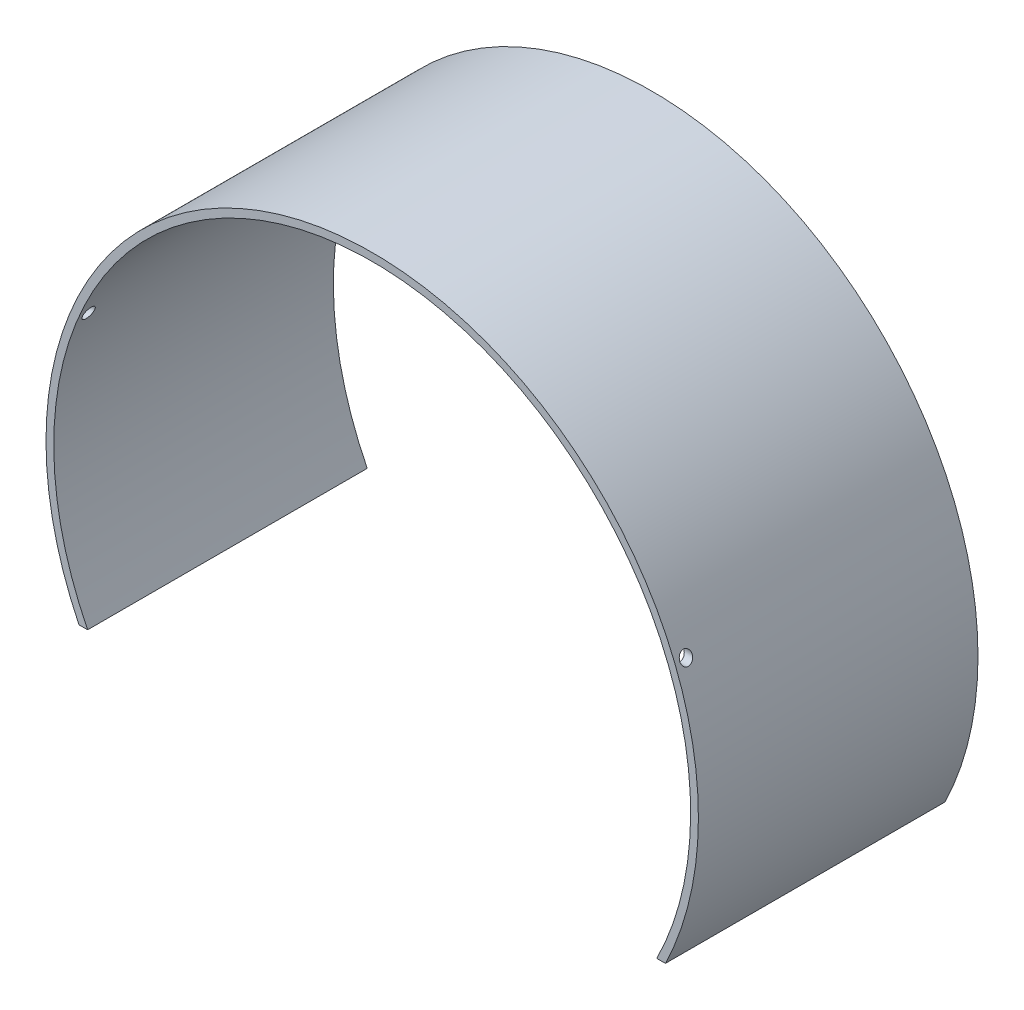
from build123d import *
from build123d.topology import SkipClean

# Parameters (mm, degrees)
SKETCH_1_R          = 210
SKETCH_1_R_2        = 203
EXTRUDE_2_DEPTH     = 174
EXTRUDE_START       = -174
EXTRUDE_4_DEPTH     = 174
CUT_EXTRUDE_1_DEPTH = 654
EXTRUDE_5_DEPTH     = 174
EXTRUDE_6_DEPTH     = 174
EXTRUDE_7_DEPTH     = 174
EXTRUDE_8_DEPTH     = 174
CUT_EXTRUDE_START   = -654
CUT_EXTRUDE_2_DEPTH = 654
SKETCH_10_W         = 20.487801248
SKETCH_10_H         = 174
CUT_EXTRUDE_3_DEPTH = 327
SKETCH_11_W         = 235.63772895
SKETCH_11_H         = 249.192111589
CUT_EXTRUDE_4_DEPTH = 238
EXTRUDE_10_DEPTH    = 180
SKETCH_17_W         = 286.098661696
SKETCH_17_H         = 191.878669743
CUT_EXTRUDE_5_DEPTH = 322
EXTRUDE_11_DEPTH    = 180
SKETCH_20_R         = 4
CUT_EXTRUDE_7_DEPTH = 555.5


with BuildPart() as part:
    # 草图1 → 凸台-拉伸2 (new body)
    with BuildSketch(Plane.XY):
        Circle(SKETCH_1_R)
        Circle(SKETCH_1_R_2, mode=Mode.SUBTRACT)
    extrude(amount=EXTRUDE_2_DEPTH)

    # 草图2 → 凸台-拉伸4 (add)
    with BuildSketch(Plane.XY.offset(174).offset(EXTRUDE_START)):
        with BuildLine():
            Line((-170.735431044, -102), (-173.735431044, -102))
            Line((-173.735431044, -102), (-175.513532242, -102))
            ThreePointArc((-175.513532242, -102), (-174.63092392, -103.50381834), (-173.735431044, -105))
            Line((-173.735431044, -105), (-170.735431044, -105))
            Line((-170.735431044, -105), (-170.735431044, -102))
        make_face()
        with BuildLine():
            ThreePointArc((173.735431044, -105), (174.63092392, -103.50381834), (175.513532242, -102))
            Line((175.513532242, -102), (173.735431044, -102))
            Line((173.735431044, -102), (170.735431044, -102))
            Line((170.735431044, -102), (170.735431044, -105))
            Line((170.735431044, -105), (173.735431044, -105))
        make_face()
    extrude(amount=EXTRUDE_4_DEPTH)

    # 草图3 → 切除-拉伸1 (cut)
    with BuildSketch(Plane.XY.offset(174)):
        Polygon((-170.735431044, -102), (238.333646515, -102), (254.334169784, 272.292523591), (-334.569415043, 221.85110305), (-306.830562533, -102), align=None)
    extrude(amount=-CUT_EXTRUDE_1_DEPTH, mode=Mode.SUBTRACT)

    # 草图5 → 凸台-拉伸5 (add)
    with BuildSketch(Plane.XY.offset(174).offset(EXTRUDE_START)):
        with BuildLine():
            Line((-120, -209.75), (-10.243900624, -209.75))
            ThreePointArc((-10.243900624, -209.75), (-67.755470707, -198.769203322), (-120, -172.336879396))
            Line((-120, -172.336879396), (-120, -209.75))
        make_face()
        with BuildLine():
            ThreePointArc((120, -172.336879396), (67.755470707, -198.769203322), (10.243900624, -209.75))
            Line((10.243900624, -209.75), (120, -209.75))
            Line((120, -209.75), (120, -172.336879396))
        make_face()
    extrude(amount=EXTRUDE_5_DEPTH)

    # 草图6 → 凸台-拉伸6 (add)
    with BuildSketch(Plane.XY.offset(174).offset(EXTRUDE_START)):
        with BuildLine():
            Line((-175.513532242, -102), (-166.195667814, -102))
            ThreePointArc((-166.195667814, -102), (0, -195), (166.195667814, -102))
            Line((166.195667814, -102), (175.513532242, -102))
            ThreePointArc((175.513532242, -102), (0, -203), (-175.513532242, -102))
        make_face()
    extrude(amount=EXTRUDE_6_DEPTH)

    # 草图7 → 凸台-拉伸7 (add)
    with BuildSketch(Plane.XY.offset(174).offset(EXTRUDE_START)):
        with BuildLine():
            Line((-166.933126535, -92), (-166.933126535, -95))
            Line((-166.933126535, -95), (-170.293863659, -95))
            ThreePointArc((-170.293863659, -95), (0, -195), (170.293863659, -95))
            Line((170.293863659, -95), (166.933126535, -95))
            Line((166.933126535, -95), (166.933126535, -92))
            Line((166.933126535, -92), (171.933126535, -92))
            Line((171.933126535, -92), (188.496850106, -92))
            ThreePointArc((188.496850106, -92), (0, -209.75), (-188.496850106, -92))
            Line((-188.496850106, -92), (-171.933126535, -92))
            Line((-171.933126535, -92), (-166.933126535, -92))
        make_face()
    extrude(amount=EXTRUDE_7_DEPTH)

    # 草图8 → 凸台-拉伸8 (add)
    with BuildSketch(Plane(origin=(0, 0, 0), x_dir=(-1, 0, 0), z_dir=(0, 0, -1))):
        with BuildLine():
            Line((166.933126535, -92), (163.933126535, -92))
            Line((163.933126535, -92), (163.933126535, -99))
            Line((163.933126535, -99), (168, -99))
            ThreePointArc((168, -99), (169.158755456, -97.006780447), (170.293863659, -95))
            Line((170.293863659, -95), (166.933126535, -95))
            Line((166.933126535, -95), (166.933126535, -92))
        make_face()
        with BuildLine():
            Line((-166.933126535, -95), (-170.293863659, -95))
            ThreePointArc((-170.293863659, -95), (-169.158755456, -97.006780447), (-168, -99))
            Line((-168, -99), (-163.933126535, -99))
            Line((-163.933126535, -99), (-163.933126535, -92))
            Line((-163.933126535, -92), (-166.933126535, -92))
            Line((-166.933126535, -92), (-166.933126535, -95))
        make_face()
    extrude(amount=-EXTRUDE_8_DEPTH)

    # 草图9 → 切除-拉伸2 (cut)
    with BuildSketch(Plane.XY.offset(174).offset(CUT_EXTRUDE_START)):
        with BuildLine():
            Line((0, -195), (0, -182.225251044))
            Line((0, -182.225251044), (-50, -182.225251044))
            Line((-50, -182.225251044), (-50, -188.48076825))
            ThreePointArc((-50, -188.48076825), (-25.211606368, -193.363323576), (0, -195))
        make_face()
        with BuildLine():
            Line((0, -209.75), (0, -195))
            ThreePointArc((0, -195), (-25.211606368, -193.363323576), (-50, -188.48076825))
            Line((-50, -188.48076825), (-50, -195))
            Line((-50, -195), (-50, -209.75))
            Line((-50, -209.75), (-10.243900624, -209.75))
            Line((-10.243900624, -209.75), (0, -209.75))
        make_face()
        with BuildLine():
            ThreePointArc((50, -188.48076825), (25.211606368, -193.363323576), (0, -195))
            Line((0, -195), (0, -209.75))
            Line((0, -209.75), (10.243900624, -209.75))
            Line((10.243900624, -209.75), (50, -209.75))
            Line((50, -209.75), (50, -195))
            Line((50, -195), (50, -188.48076825))
        make_face()
        with BuildLine():
            Line((50, -182.225251044), (0, -182.225251044))
            Line((0, -182.225251044), (0, -195))
            ThreePointArc((0, -195), (25.211606368, -193.363323576), (50, -188.48076825))
            Line((50, -188.48076825), (50, -182.225251044))
        make_face()
    extrude(amount=CUT_EXTRUDE_2_DEPTH, mode=Mode.SUBTRACT)


with BuildPart() as cut_extrude_2_piece_1:
    # of the separate pieces the step leaves, piece 1, a body of its own (cut_extrude_2_pieces)
    add(part.part.solids().sort_by_distance((-183.564702489, -102, 0))[0])

    # 草图11 → 切除-拉伸4 (cut)
    with BuildSketch(Plane(origin=(0, 0, 0), x_dir=(-1, 0, 0), z_dir=(0, 0, -1))):
        with Locations((136.586471206, -141.23053543)):
            Rectangle(SKETCH_11_W, SKETCH_11_H)
    extrude(amount=-CUT_EXTRUDE_4_DEPTH, mode=Mode.SUBTRACT)


with BuildPart() as cut_extrude_2_piece_2:
    # of the separate pieces the step leaves, piece 2, a body of its own (cut_extrude_2_pieces)
    add(part.part.solids().sort_by_distance((50, -188.48076825, 0))[0])

    # 草图17 → 切除-拉伸5 (cut)
    with BuildSketch(Plane(origin=(0, -92, 0), x_dir=(1, 0, 0), z_dir=(0, 1, 0))):
        with Locations((123.864076708, -90.777636372)):
            Rectangle(SKETCH_17_W, SKETCH_17_H)
    extrude(amount=-CUT_EXTRUDE_5_DEPTH, mode=Mode.SUBTRACT)


with BuildPart() as cut_extrude_2_piece_3:
    # of the separate pieces the step leaves, piece 3, a body of its own (cut_extrude_2_pieces)
    add(part.part.solids().sort_by_distance((10.243900624, -209.75, 0))[0])

    # 草图10 → 切除-拉伸3 (cut, symmetric)
    with BuildSketch(Plane(origin=(0, -209.75, 0), x_dir=(1, 0, 0), z_dir=(0, 1, 0))):
        with Locations((0, -87)):
            Rectangle(SKETCH_10_W, SKETCH_10_H)
    extrude(amount=CUT_EXTRUDE_3_DEPTH, both=True, mode=Mode.SUBTRACT)


with BuildPart() as body_2:
    # 草图14 → 凸台-拉伸10 (new body)
    with BuildSketch(Plane.XY.offset(209.75)):
        with BuildLine():
            Line((0, 210), (0, 205))
            ThreePointArc((0, 205), (174.477792283, 107.622023768), (183.196615689, -92))
            Line((183.196615689, -92), (188.774998345, -92))
            ThreePointArc((188.774998345, -92), (178.073018731, 111.310376875), (0, 210))
        make_face()
    extrude(amount=EXTRUDE_10_DEPTH)

    # 草图18 → 凸台-拉伸11 (add)
    with SkipClean():  # the faces are left unmerged after this step: merging them gives an invalid solid
        with BuildSketch(Plane.XY.offset(389.75)):
            with BuildLine():
                ThreePointArc((0, 210), (-178.073018731, 111.310376875), (-188.774998345, -92))
                Line((-188.774998345, -92), (-183.196615689, -92))
                ThreePointArc((-183.196615689, -92), (-174.477792283, 107.622023768), (0, 205))
                Line((0, 205), (0, 210))
            make_face()
        extrude(amount=-EXTRUDE_11_DEPTH)

    # 草图20 → 切除-拉伸7 (cut, symmetric)
    with SkipClean():  # the faces are left unmerged after this step: merging them gives an invalid solid
        with BuildSketch(Plane(origin=(0, 0, 0), x_dir=(0, 0, -1), z_dir=(1, 0, 0))):
            with Locations((-382.75, 78)):
                Circle(SKETCH_20_R)
        extrude(amount=CUT_EXTRUDE_7_DEPTH, both=True, mode=Mode.SUBTRACT)


solid = body_2.part
